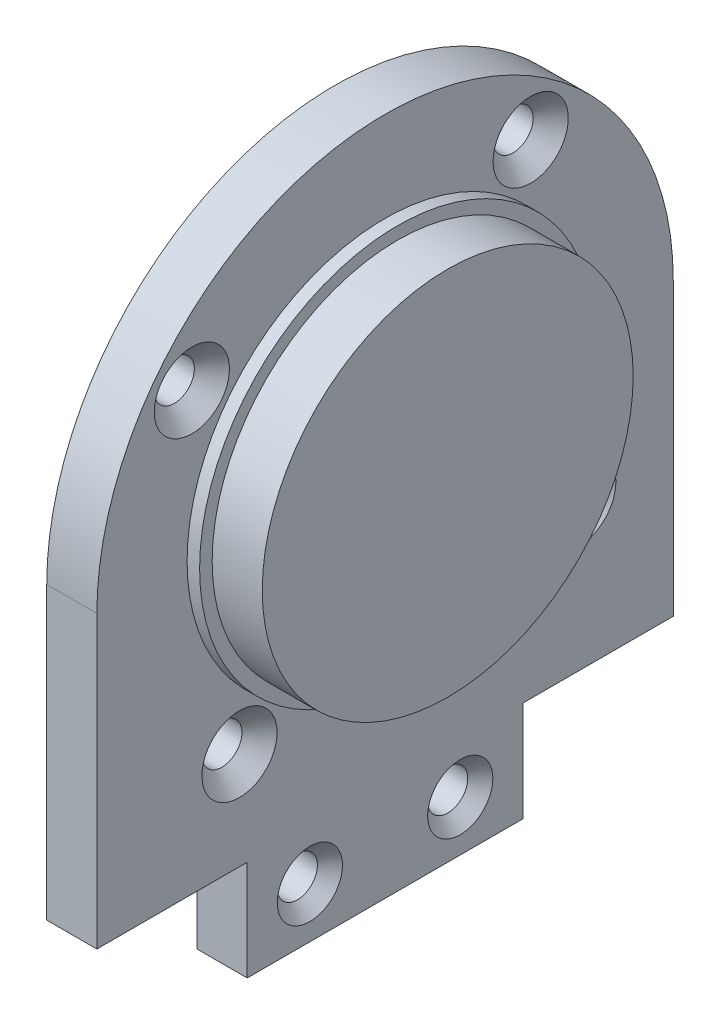
from build123d import *

# Parameters (mm, degrees)
SKETCH_1_R      = 1.6
SKETCH_1_R_2    = 14.8
EXTRUDE_4_DEPTH = 4
SKETCH_1_6_W    = 22
SKETCH_1_6_H    = 8
SKETCH_1_6_R    = 1.6
EXTRUDE_5_DEPTH = 4
CHAMFER_1_SIZE  = 1.4
CHAMFER_2_SIZE  = 1
CHAMFER_3_SIZE  = 1
SKETCH_1_7_R    = 14.8
EXTRUDE_6_DEPTH = 9
SKETCH_2_R      = 15.8
EXTRUDE_7_DEPTH = 1


with BuildPart() as part:
    # 草图1 → 凸台-拉伸4 (new body)
    with BuildSketch(Plane(origin=(0, 0, 0), x_dir=(0, 0, -1), z_dir=(1, 0, 0))):
        with BuildLine():
            Line((23, -23.2), (23, 0))
            ThreePointArc((23, 0), (0, 23), (-23, 0))
            Line((-23, 0), (-23, -23.2))
            Line((-23, -23.2), (23, -23.2))
        make_face()
        with Locations((11.619884993, 15.420108208)):
            Circle(SKETCH_1_R, mode=Mode.SUBTRACT)
        with Locations((-11.619884993, -15.420108208)):
            Circle(SKETCH_1_R, mode=Mode.SUBTRACT)
        with Locations((15.420108208, -11.619884993)):
            Circle(SKETCH_1_R, mode=Mode.SUBTRACT)
        with Locations((-15.420108208, 11.619884993)):
            Circle(SKETCH_1_R, mode=Mode.SUBTRACT)
        Circle(SKETCH_1_R_2, mode=Mode.SUBTRACT)
    extrude(amount=EXTRUDE_4_DEPTH)

    # 草图1<6> → 凸台-拉伸5 (add)
    with BuildSketch(Plane(origin=(0, 0, 0), x_dir=(0, 0, -1), z_dir=(1, 0, 0))):
        with Locations((0, -27.2)):
            Rectangle(SKETCH_1_6_W, SKETCH_1_6_H)
        with Locations((-6, -27.2)):
            Circle(SKETCH_1_6_R, mode=Mode.SUBTRACT)
        with Locations((6, -27.2)):
            Circle(SKETCH_1_6_R, mode=Mode.SUBTRACT)
    extrude(amount=EXTRUDE_5_DEPTH)

    # 倒角1
    chamfer_1_edges = [part.edges().sort_by_distance(p)[0] for p in [
        (4, -11.619884993, -13.820108208),
        (4, -15.420108208, 13.219884993),
        (4, 15.420108208, -10.019884993),
        (4, 11.619884993, 17.020108208),
    ]]
    chamfer(chamfer_1_edges, length=CHAMFER_1_SIZE)

    # 倒角2
    chamfer_2_edges = [part.edges().sort_by_distance(p)[0] for p in [
        (4, -27.2, 7.6),
    ]]
    chamfer(chamfer_2_edges, length=CHAMFER_2_SIZE)

    # 倒角3
    chamfer_3_edges = [part.edges().sort_by_distance(p)[0] for p in [
        (4, -27.2, -4.4),
    ]]
    chamfer(chamfer_3_edges, length=CHAMFER_3_SIZE)

    # 草图1<7> → 凸台-拉伸6 (add)
    with BuildSketch(Plane(origin=(0, 0, 0), x_dir=(0, 0, -1), z_dir=(1, 0, 0))):
        Circle(SKETCH_1_7_R)
    extrude(amount=EXTRUDE_6_DEPTH)

    # 草图2 → 凸台-拉伸7 (add)
    with BuildSketch(Plane(origin=(4, 0, 0), x_dir=(0, 0, -1), z_dir=(1, 0, 0))):
        Circle(SKETCH_2_R)
    extrude(amount=EXTRUDE_7_DEPTH)


solid = part.part
